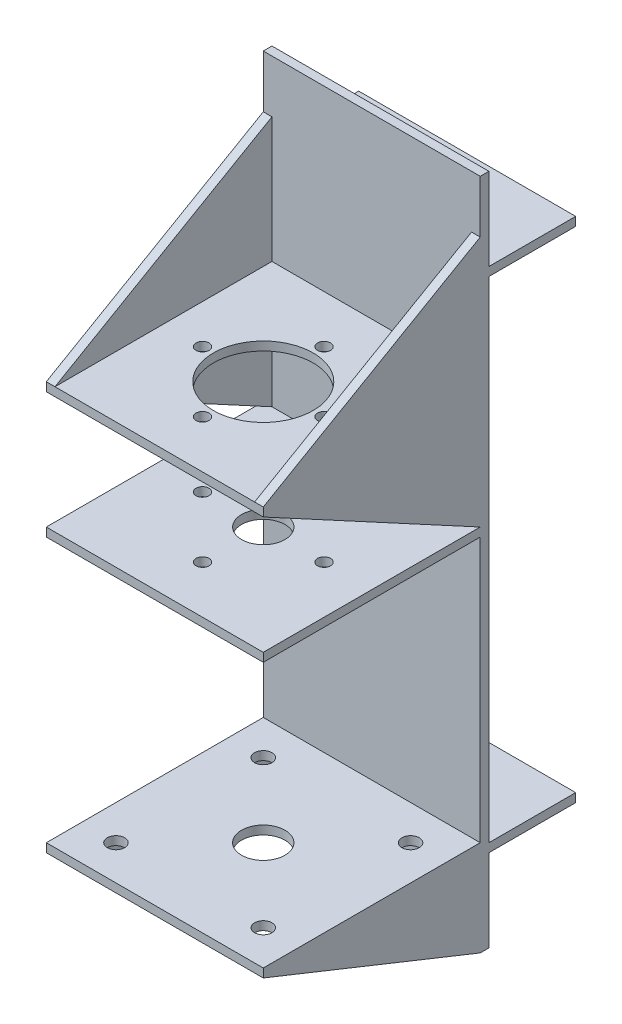
from build123d import *

# Parameters (mm, degrees)
SKETCH1_W           = 50
SKETCH1_H           = 155
BOSS_EXTRUDE1_DEPTH = 2
SKETCH2_W           = 50
SKETCH2_H           = 2
BOSS_EXTRUDE2_DEPTH = 50
SKETCH3_W           = 50
SKETCH3_H           = 2
BOSS_EXTRUDE3_DEPTH = 50
SKETCH4_R           = 2
CUT_EXTRUDE1_DEPTH  = 145.97586006
SKETCH5_R           = 5
CUT_EXTRUDE2_DEPTH  = 103.732662771
SKETCH6_R           = 1.5
CUT_EXTRUDE3_DEPTH  = 102.084123382
SKETCH7_W           = 50
SKETCH7_H           = 2
BOSS_EXTRUDE4_DEPTH = 50
CUT_EXTRUDE5_REACH  = 129.769
SKETCH9_R           = 11.5
SKETCH9_R_2         = 1.5
BOSS_EXTRUDE5_DEPTH = 2
BOSS_EXTRUDE6_DEPTH = 20


with BuildPart() as part:
    # Sketch1 → Boss-Extrude1 (new body)
    with BuildSketch(Plane.XY):
        Rectangle(SKETCH1_W, SKETCH1_H)
    extrude(amount=BOSS_EXTRUDE1_DEPTH)

    # Sketch2 → Boss-Extrude2 (add)
    with BuildSketch(Plane.XY.offset(2)):
        with Locations((0, -56.5)):
            Rectangle(SKETCH2_W, SKETCH2_H)
    extrude(amount=BOSS_EXTRUDE2_DEPTH)

    # Sketch3 → Boss-Extrude3 (add)
    with BuildSketch(Plane.XY.offset(2)):
        with Locations((0, 6.5)):
            Rectangle(SKETCH3_W, SKETCH3_H)
    extrude(amount=BOSS_EXTRUDE3_DEPTH)

    # Sketch4 → Cut-Extrude1 (cut, through all)
    with BuildSketch(Plane(origin=(0, -55.5, 0), x_dir=(1, 0, 0), z_dir=(0, 1, 0))):
        with Locations((-16.970562748, -43.970562748)):
            Circle(SKETCH4_R)
        with Locations((16.970562748, -43.970562748)):
            Circle(SKETCH4_R)
        with Locations((16.970562748, -10.029437252)):
            Circle(SKETCH4_R)
        with Locations((-16.970562748, -10.029437252)):
            Circle(SKETCH4_R)
    extrude(amount=-CUT_EXTRUDE1_DEPTH, mode=Mode.SUBTRACT)

    # Sketch5 → Cut-Extrude2 (cut, through all)
    with BuildSketch(Plane(origin=(0, 7.5, 0), x_dir=(1, 0, 0), z_dir=(0, 1, 0))):
        with Locations((0, -27)):
            Circle(SKETCH5_R)
    extrude(amount=-CUT_EXTRUDE2_DEPTH, mode=Mode.SUBTRACT)

    # Sketch6 → Cut-Extrude3 (cut, through all)
    with BuildSketch(Plane.XZ.offset(-5.5)):
        with Locations((0, 41)):
            Circle(SKETCH6_R)
        with Locations((14, 27)):
            Circle(SKETCH6_R)
        with Locations((0, 13)):
            Circle(SKETCH6_R)
        with Locations((-14, 27)):
            Circle(SKETCH6_R)
    extrude(amount=-CUT_EXTRUDE3_DEPTH, mode=Mode.SUBTRACT)

    # Sketch7 → Boss-Extrude4 (add)
    with BuildSketch(Plane.XY.offset(2)):
        with Locations((0, 35.5)):
            Rectangle(SKETCH7_W, SKETCH7_H)
    extrude(amount=BOSS_EXTRUDE4_DEPTH)

    # Sketch9 → Cut-Extrude5 (cut, up to next)
    with BuildSketch(Plane(origin=(0, 36.5, 0), x_dir=(1, 0, 0), z_dir=(0, 1, 0)), mode=Mode.PRIVATE) as cut_extrude5_sk1:
        with Locations((0, -27)):
            Circle(SKETCH9_R)
    cut_extrude5_tool1 = extrude(cut_extrude5_sk1.sketch, amount=-CUT_EXTRUDE5_REACH, mode=Mode.PRIVATE) & part.part
    # Sketch9 → Cut-Extrude5 (cut, up to next)
    with BuildSketch(Plane(origin=(0, 36.5, 0), x_dir=(1, 0, 0), z_dir=(0, 1, 0)), mode=Mode.PRIVATE) as cut_extrude5_sk2:
        with Locations((-14, -27)):
            Circle(SKETCH9_R_2)
    cut_extrude5_tool2 = extrude(cut_extrude5_sk2.sketch, amount=-CUT_EXTRUDE5_REACH, mode=Mode.PRIVATE) & part.part
    # Sketch9 → Cut-Extrude5 (cut, up to next)
    with BuildSketch(Plane(origin=(0, 36.5, 0), x_dir=(1, 0, 0), z_dir=(0, 1, 0)), mode=Mode.PRIVATE) as cut_extrude5_sk3:
        with Locations((0, -41)):
            Circle(SKETCH9_R_2)
    cut_extrude5_tool3 = extrude(cut_extrude5_sk3.sketch, amount=-CUT_EXTRUDE5_REACH, mode=Mode.PRIVATE) & part.part
    # Sketch9 → Cut-Extrude5 (cut, up to next)
    with BuildSketch(Plane(origin=(0, 36.5, 0), x_dir=(1, 0, 0), z_dir=(0, 1, 0)), mode=Mode.PRIVATE) as cut_extrude5_sk4:
        with Locations((14, -27)):
            Circle(SKETCH9_R_2)
    cut_extrude5_tool4 = extrude(cut_extrude5_sk4.sketch, amount=-CUT_EXTRUDE5_REACH, mode=Mode.PRIVATE) & part.part
    # Sketch9 → Cut-Extrude5 (cut, up to next)
    with BuildSketch(Plane(origin=(0, 36.5, 0), x_dir=(1, 0, 0), z_dir=(0, 1, 0)), mode=Mode.PRIVATE) as cut_extrude5_sk5:
        with Locations((0, -13)):
            Circle(SKETCH9_R_2)
    cut_extrude5_tool5 = extrude(cut_extrude5_sk5.sketch, amount=-CUT_EXTRUDE5_REACH, mode=Mode.PRIVATE) & part.part
    add(cut_extrude5_tool1.solids().sort_by_distance((0, 36.5, 27))[0], mode=Mode.SUBTRACT)
    add(cut_extrude5_tool2.solids().sort_by_distance((-14, 36.5, 27))[0], mode=Mode.SUBTRACT)
    add(cut_extrude5_tool3.solids().sort_by_distance((0, 36.5, 41))[0], mode=Mode.SUBTRACT)
    add(cut_extrude5_tool4.solids().sort_by_distance((14, 36.5, 27))[0], mode=Mode.SUBTRACT)
    add(cut_extrude5_tool5.solids().sort_by_distance((0, 36.5, 13))[0], mode=Mode.SUBTRACT)

    # Sketch12 → Boss-Extrude5 (add)
    with BuildSketch(Plane.ZY.offset(25)):
        Polygon((2, 65.367513459), (52, 36.5), (2, 36.5), align=None)
        Polygon((2, -77.5), (2, -57.5), (52, -57.5), align=None)
        Polygon((2, 34.5), (52, 34.5), (2, 7.5), align=None)
    boss_extrude5 = extrude(amount=-BOSS_EXTRUDE5_DEPTH)

    # Mirror1: Boss-Extrude5 across plane
    add(boss_extrude5.mirror(Plane(origin=(0, 0, 0), x_dir=(0, 0, 1), z_dir=(1, 0, 0))))

    # Sketch13 → Boss-Extrude6 (add)
    with BuildSketch(Plane(origin=(0, 0, 0), x_dir=(-1, 0, 0), z_dir=(0, 0, -1))):
        Polygon((-25, 58.5), (25, 58.5), (25, 56.5), (1, 56.5), (1, -56.5), (25, -56.5), (25, -58.5), (-25, -58.5), (-25, -56.5), (-1, -56.5), (-1, 56.5), (-25, 56.5), align=None)
    extrude(amount=BOSS_EXTRUDE6_DEPTH)


solid = part.part
